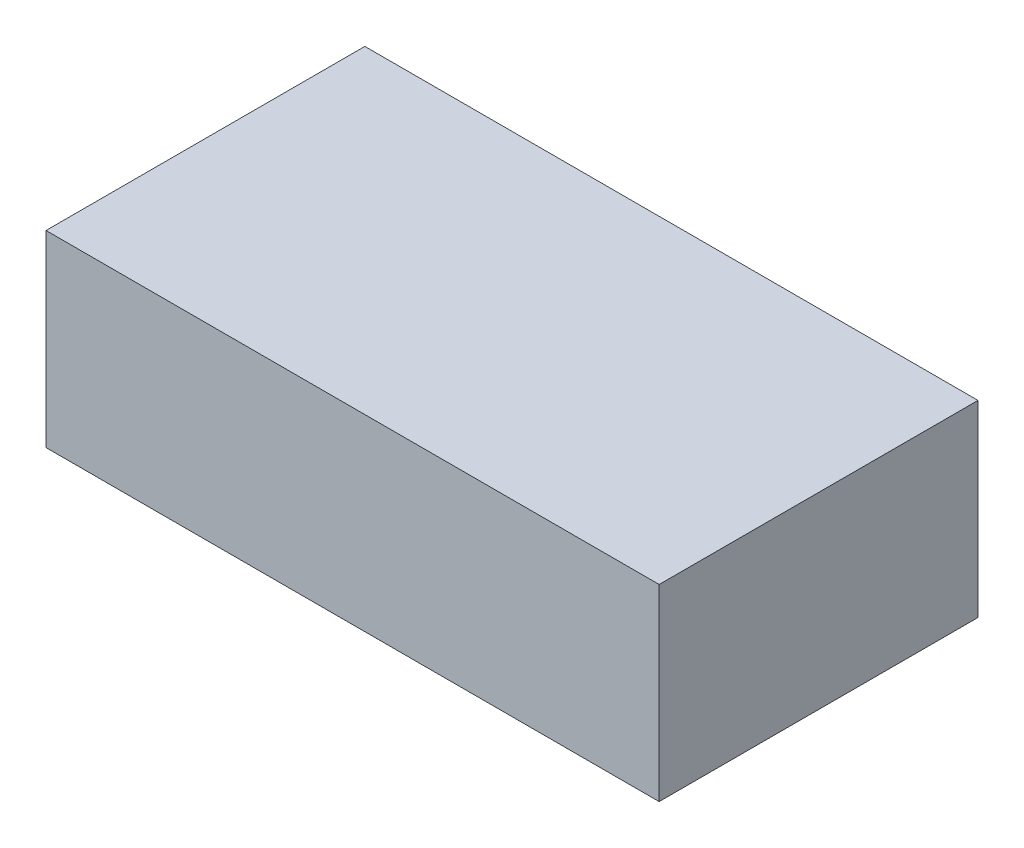
from build123d import *

# Parameters (mm, degrees)
SKETCH1_W     = 75
SKETCH1_H     = 23
PROFILE_DEPTH = 39


with BuildPart() as part:
    # Sketch1 → Profile (new body)
    with BuildSketch(Plane.XY):
        with Locations((37.5, 11.5)):
            Rectangle(SKETCH1_W, SKETCH1_H)
    extrude(amount=PROFILE_DEPTH)


solid = part.part
